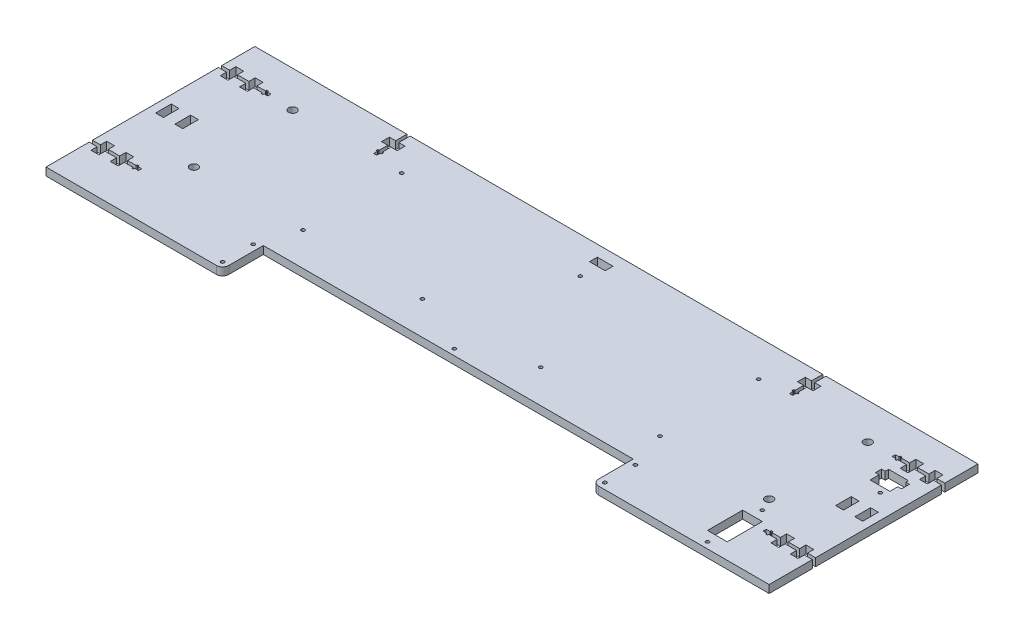
from build123d import *

# Parameters (mm, degrees)
SKETCH1_W             = 609.6
SKETCH1_H             = 304.8
MDFSTOCK_DEPTH        = 6.35
SKETCH2_R             = 1.4
SKETCH2_W             = 300
SKETCH2_H             = 33
BEDVERGEHOLES_DEPTH   = 341.835917268
FILLET1_R             = 5
SKETCH3_W             = 6.35
SKETCH3_H             = 12.7
SIDINGHOLES_DEPTH     = 341.835917268
SKETCH5_W             = 12.7
SKETCH5_H             = 6.35
BACKINGHOLES_DEPTH    = 331.547492805
SKETCH6_R             = 3.25
LEGHOLES_DEPTH        = 331.547492805
SKETCH7_W             = 10.35
SKETCH7_H             = 4.5
SKETCH7_W_2           = 5.65
SKETCH7_W_3           = 16
SKETCH7_H_2           = 10.5
SKETCH7_W_4           = 3
SKETCH7_H_3           = 6.5
SKETCH7_H_4           = 5
SKETCH7_R             = 1.4
LIMITSWITCHHOLE_DEPTH = 331.547492805
SKETCH8_R             = 1.4
SKETCH8_W             = 16
SKETCH8_H             = 28.5
EMERGENCYSTOP_DEPTH   = 10


with BuildPart() as part:
    # Sketch1 → MDFstock (new body)
    with BuildSketch(Plane(origin=(0, 0, 0), x_dir=(1, 0, 0), z_dir=(0, 1, 0))):
        Rectangle(SKETCH1_W, SKETCH1_H)
    extrude(amount=MDFSTOCK_DEPTH)

    # Sketch2 → bedVergeHoles (cut, through all)
    with BuildSketch(Plane(origin=(0, 0, 0), x_dir=(1, 0, 0), z_dir=(0, 1, 0))):
        with Locations(Location((-144.75, -92.4, 0), (0, 0, 270))):
            Circle(SKETCH2_R)
        with Locations(Location((-48, -92.4, 0), (0, 0, 270))):
            Circle(SKETCH2_R)
        with Locations(Location((48, -92.4, 0), (0, 0, 270))):
            Circle(SKETCH2_R)
        with Locations(Location((144.75, -92.4, 0), (0, 0, 270))):
            Circle(SKETCH2_R)
        with Locations(Location((-144.75, -12.4, 0), (0, 0, 270))):
            Circle(SKETCH2_R)
        with Locations(Location((0, -12.4, 0), (0, 0, 270))):
            Circle(SKETCH2_R)
        with Locations(Location((144.75, -12.4, 0), (0, 0, 270))):
            Circle(SKETCH2_R)
        with Locations(Location((-155, -122.65, 0), (0, 0, 270))):
            Circle(SKETCH2_R)
        with Locations(Location((-155, -147.4, 0), (0, 0, 270))):
            Circle(SKETCH2_R)
        with Locations(Location((155, -122.65, 0), (0, 0, 270))):
            Circle(SKETCH2_R)
        with Locations(Location((155, -147.4, 0), (0, 0, 270))):
            Circle(SKETCH2_R)
        with Locations(Location((0, -114.4, 0), (0, 0, 270))):
            Circle(SKETCH2_R)
        with Locations((0, -135.9)):
            Rectangle(SKETCH2_W, SKETCH2_H)
    extrude(amount=BEDVERGEHOLES_DEPTH, mode=Mode.SUBTRACT)

    # Fillet1
    fillet1_edges = [part.edges().sort_by_distance(p)[0] for p in [
        (-150, 3.175, 152.4),
        (150, 3.175, 152.4),
    ]]
    fillet(fillet1_edges, radius=FILLET1_R)

    # Sketch3 → sidingHoles (cut, through all)
    with BuildSketch(Plane(origin=(0, 6.35, 0), x_dir=(1, 0, 0), z_dir=(0, 1, 0))):
        Polygon((-264.75, -114.75), (-264.75, -109.7), (-271.1, -109.7), (-271.1, -114.75), (-280.4, -114.75), (-280.4, -109.7), (-286.75, -109.7), (-286.75, -114.75), (-293.25, -114.75), (-293.25, -12.55), (-286.75, -12.55), (-286.75, -17.6), (-280.4, -17.6), (-280.4, -12.55), (-271.1, -12.55), (-271.1, -17.6), (-264.75, -17.6), (-264.75, -12.55), (-257.75, -12.55), (-257.75, -13.55), (-256.25, -13.55), (-256.25, -12.55), (-253.25, -12.55), (-253.25, -9.95), (-256.25, -9.95), (-256.25, -8.95), (-257.75, -8.95), (-257.75, -9.95), (-264.75, -9.95), (-264.75, -4.9), (-271.1, -4.9), (-271.1, -9.95), (-280.4, -9.95), (-280.4, -4.9), (-286.75, -4.9), (-286.75, -9.95), (-293.25, -9.95), (-293.25, 152.4), (-304.8, 152.4), (-304.8, -152.4), (-293.25, -152.4), (-293.25, -117.35), (-286.75, -117.35), (-286.75, -122.4), (-280.4, -122.4), (-280.4, -117.35), (-271.1, -117.35), (-271.1, -122.4), (-264.75, -122.4), (-264.75, -117.35), (-257.75, -117.35), (-257.75, -118.35), (-256.25, -118.35), (-256.25, -117.35), (-253.25, -117.35), (-253.25, -114.75), (-256.25, -114.75), (-256.25, -113.75), (-257.75, -113.75), (-257.75, -114.75), align=None)
        with Locations((-283.575, -63.65)):
            Rectangle(SKETCH3_W, SKETCH3_H)
        with Locations((-267.925, -63.65)):
            Rectangle(SKETCH3_W, SKETCH3_H)
        Polygon((264.75, -12.55), (264.75, -17.6), (271.1, -17.6), (271.1, -12.55), (280.4, -12.55), (280.4, -17.6), (286.75, -17.6), (286.75, -12.55), (293.25, -12.55), (293.25, -114.75), (286.75, -114.75), (286.75, -109.7), (280.4, -109.7), (280.4, -114.75), (271.1, -114.75), (271.1, -109.7), (264.75, -109.7), (264.75, -114.75), (257.75, -114.75), (257.75, -113.75), (256.25, -113.75), (256.25, -114.75), (253.25, -114.75), (253.25, -117.35), (256.25, -117.35), (256.25, -118.35), (257.75, -118.35), (257.75, -117.35), (264.75, -117.35), (264.75, -122.4), (271.1, -122.4), (271.1, -117.35), (280.4, -117.35), (280.4, -122.4), (286.75, -122.4), (286.75, -117.35), (293.25, -117.35), (293.25, -152.4), (304.8, -152.4), (304.8, 152.4), (293.25, 152.4), (293.25, -9.95), (286.75, -9.95), (286.75, -4.9), (280.4, -4.9), (280.4, -9.95), (271.1, -9.95), (271.1, -4.9), (264.75, -4.9), (264.75, -9.95), (257.75, -9.95), (257.75, -8.95), (256.25, -8.95), (256.25, -9.95), (253.25, -9.95), (253.25, -12.55), (256.25, -12.55), (256.25, -13.55), (257.75, -13.55), (257.75, -12.55), align=None)
        with Locations((267.925, -63.65)):
            Rectangle(SKETCH3_W, SKETCH3_H)
        with Locations((283.575, -63.65)):
            Rectangle(SKETCH3_W, SKETCH3_H)
    extrude(amount=-SIDINGHOLES_DEPTH, mode=Mode.SUBTRACT)

    # Sketch5 → backingHoles (cut, through all)
    with BuildSketch(Plane(origin=(0, 6.35, 0), x_dir=(1, 0, 0), z_dir=(0, 1, 0))):
        Polygon((-169.95, 7.85), (-175, 7.85), (-175, 1.5), (-169.95, 1.5), (-169.95, -5.5), (-170.95, -5.5), (-170.95, -7), (-169.95, -7), (-169.95, -10), (-167.35, -10), (-167.35, -7), (-166.35, -7), (-166.35, -5.5), (-167.35, -5.5), (-167.35, 1.5), (-162.3, 1.5), (-162.3, 7.85), (-167.35, 7.85), (-167.35, 17), (167.35, 17), (167.35, 7.85), (162.3, 7.85), (162.3, 1.5), (167.35, 1.5), (167.35, -5.5), (166.35, -5.5), (166.35, -7), (167.35, -7), (167.35, -10), (169.95, -10), (169.95, -7), (170.95, -7), (170.95, -5.5), (169.95, -5.5), (169.95, 1.5), (175, 1.5), (175, 7.85), (169.95, 7.85), (169.95, 17), (293.25, 17), (293.25, 152.4), (-293.25, 152.4), (-293.25, 17), (-169.95, 17), align=None)
        with Locations((0, 4.675)):
            Rectangle(SKETCH5_W, SKETCH5_H)
    extrude(amount=-BACKINGHOLES_DEPTH, mode=Mode.SUBTRACT)

    # Sketch6 → legHoles (cut, through all)
    with BuildSketch(Plane(origin=(0, 6.35, 0), x_dir=(1, 0, 0), z_dir=(0, 1, 0))):
        with Locations(Location((-233.25, -92.4, 0), (0, 0, 270))):
            Circle(SKETCH6_R)
        with Locations(Location((-233.25, -12.4, 0), (0, 0, 270))):
            Circle(SKETCH6_R)
        with Locations(Location((233.25, -92.4, 0), (0, 0, 270))):
            Circle(SKETCH6_R)
        with Locations(Location((233.25, -12.4, 0), (0, 0, 270))):
            Circle(SKETCH6_R)
    extrude(amount=-LEGHOLES_DEPTH, mode=Mode.SUBTRACT)

    # Sketch7 → limitSwitchHole (cut, through all)
    with BuildSketch(Plane(origin=(0, 6.35, 0), x_dir=(1, 0, 0), z_dir=(0, 1, 0))):
        with Locations((265.925, -35.75)):
            Rectangle(SKETCH7_W, SKETCH7_H)
        with Locations((273.925, -35.75)):
            Rectangle(SKETCH7_W_2, SKETCH7_H)
        with Locations((268.75, -28.25)):
            Rectangle(SKETCH7_W_3, SKETCH7_H_2)
        with Locations((278.25, -28.25)):
            Rectangle(SKETCH7_W_4, SKETCH7_H_3)
        with Locations((259.25, -28.25)):
            Rectangle(SKETCH7_W_4, SKETCH7_H_4)
        with Locations(Location((273.925, -42.9, 0), (0, 0, 270))):
            Circle(SKETCH7_R)
    extrude(amount=-LIMITSWITCHHOLE_DEPTH, mode=Mode.SUBTRACT)

    # Sketch8 → EmergencyStop (cut)
    with BuildSketch(Plane(origin=(0, 6.35, 0), x_dir=(1, 0, 0), z_dir=(0, 1, 0))):
        with Locations(Location((238.25, -102.9, 0), (0, 0, 270))):
            Circle(SKETCH8_R)
        with Locations(Location((238.25, -147.4, 0), (0, 0, 270))):
            Circle(SKETCH8_R)
        with Locations((238.25, -125.15)):
            Rectangle(SKETCH8_W, SKETCH8_H)
    extrude(amount=-EMERGENCYSTOP_DEPTH, mode=Mode.SUBTRACT)


solid = part.part
